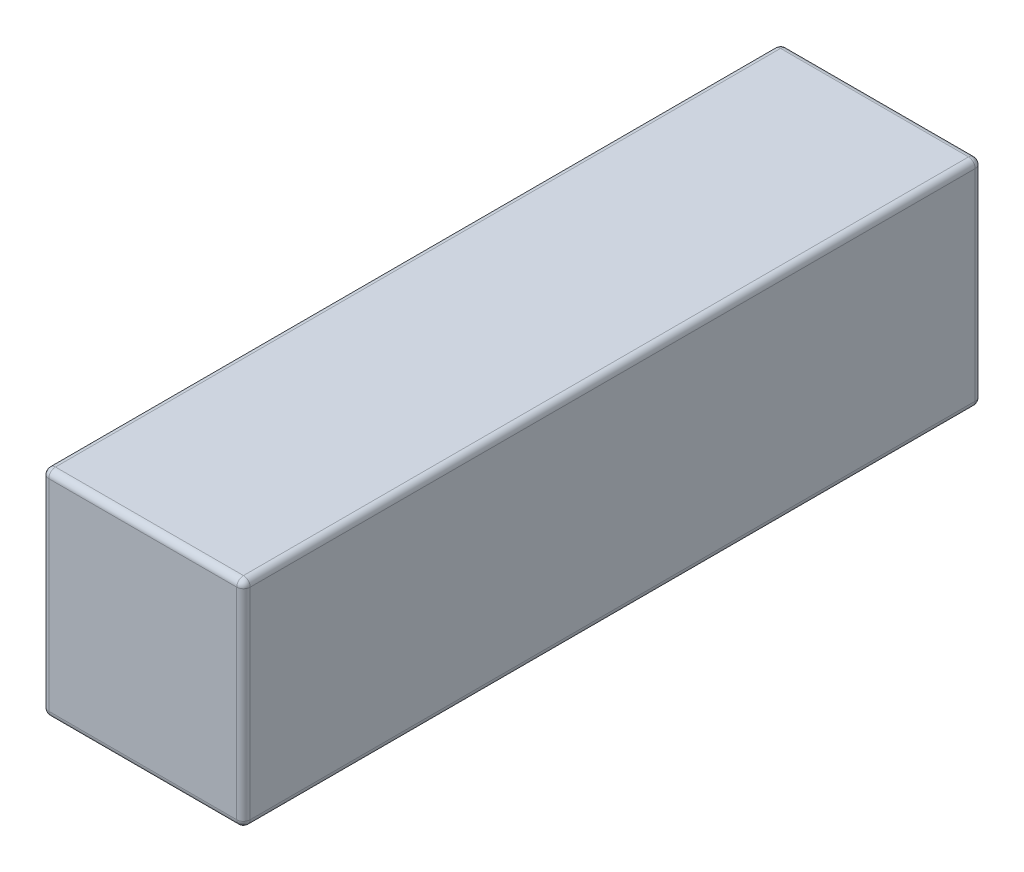
from build123d import *

# Parameters (mm, degrees)
SKETCH1_W           = 30
SKETCH1_H           = 110
BOSS_EXTRUDE1_DEPTH = 32
FILLET1_R           = 1


with BuildPart() as part:
    # Sketch1 → Boss-Extrude1 (new body)
    with BuildSketch(Plane(origin=(0, 0, 0), x_dir=(1, 0, 0), z_dir=(0, 1, 0))):
        with Locations((0, -4.553571429)):
            Rectangle(SKETCH1_W, SKETCH1_H)
    extrude(amount=BOSS_EXTRUDE1_DEPTH)

    # Fillet1
    fillet1_edges = [part.edges().sort_by_distance(p)[0] for p in [
        (15, 32, 4.553571429),
        (0, 32, -50.446428571),
        (-15, 32, 4.553571429),
        (0, 0, -50.446428571),
        (15, 0, 4.553571429),
        (0, 0, 59.553571429),
        (-15, 0, 4.553571429),
        (0, 32, 59.553571429),
        (-15, 16, -50.446428571),
        (15, 16, -50.446428571),
        (15, 16, 59.553571429),
        (-15, 16, 59.553571429),
    ]]
    fillet(fillet1_edges, radius=FILLET1_R)


solid = part.part
